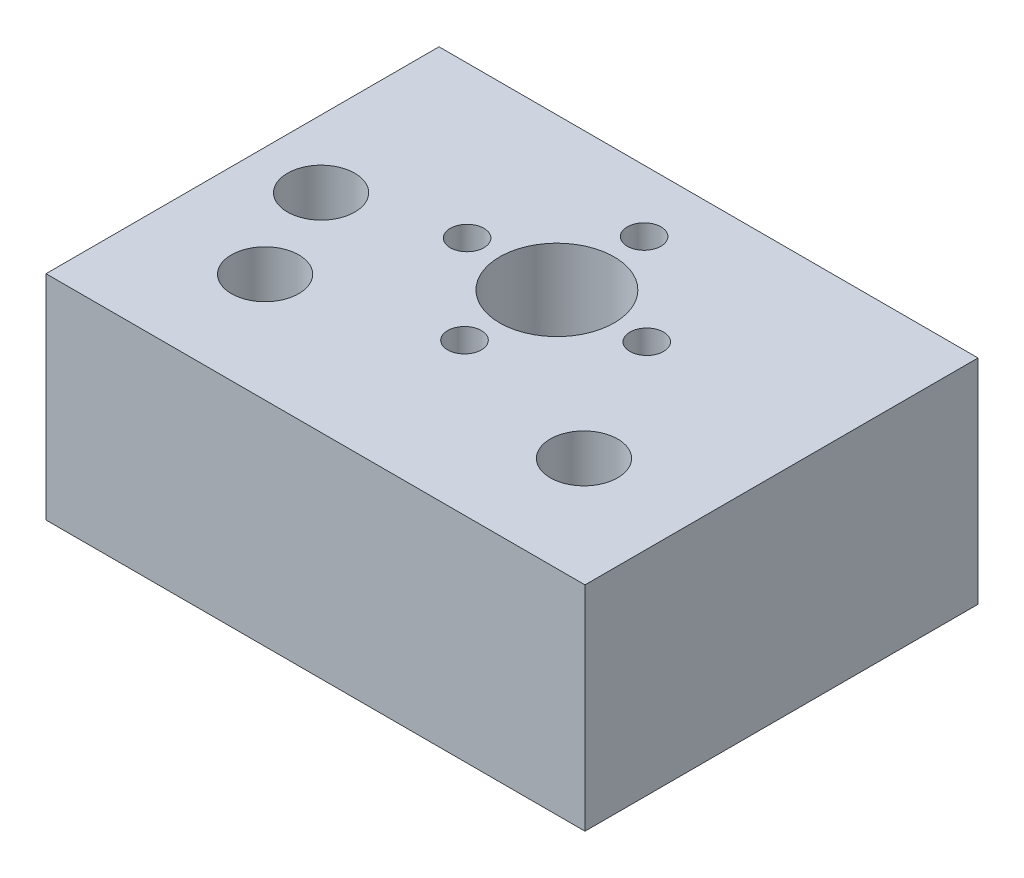
from build123d import *

# Parameters (mm, degrees)
ESBO_O1_W                = 48
ESBO_O1_H                = 35
RESSALTO_EXTRUS_O1_DEPTH = 19
ESBO_O4_R                = 5.1
CORTE_EXTRUS_O3_DEPTH    = 25
ESBO_O7_R                = 3
CORTE_EXTRUS_O7_DEPTH    = 63.369864518
ESBO_O8_R                = 3
CORTE_EXTRUS_O8_DEPTH    = 63.369864518
ESBO_O9_R                = 2
CORTE_EXTRUS_O9_DEPTH    = 17
ESBO_O6_R                = 1.5
CORTE_EXTRUS_O10_DEPTH   = 10


with BuildPart() as part:
    # Esboço1 → Ressalto-extrusão1 (new body)
    with BuildSketch(Plane(origin=(0, 0, 0), x_dir=(1, 0, 0), z_dir=(0, 1, 0))):
        with Locations((24, 17.5)):
            Rectangle(ESBO_O1_W, ESBO_O1_H)
    extrude(amount=RESSALTO_EXTRUS_O1_DEPTH)

    # Esboço4 → Corte-extrusão3 (cut)
    with BuildSketch(Plane(origin=(0, 19, 0), x_dir=(1, 0, 0), z_dir=(0, 1, 0))):
        with Locations(Location((24, 21.5, 0), (0, 0, 270))):
            Circle(ESBO_O4_R)
    extrude(amount=-CORTE_EXTRUS_O3_DEPTH, mode=Mode.SUBTRACT)

    # Esboço7 → Corte-extrusão7 (cut, through all)
    with BuildSketch(Plane(origin=(0, 19, 0), x_dir=(1, 0, 0), z_dir=(0, 1, 0))):
        with Locations(Location((9.8, 9.71, 0), (0, 0, 270))):
            Circle(ESBO_O7_R)
        with Locations(Location((38.2, 9.71, 0), (0, 0, 270))):
            Circle(ESBO_O7_R)
    extrude(amount=-CORTE_EXTRUS_O7_DEPTH, mode=Mode.SUBTRACT)

    # Esboço8 → Corte-extrusão8 (cut, through all)
    with BuildSketch(Plane.XZ):
        with Locations(Location((6, -18.5, 0), (0, 0, 270))):
            Circle(ESBO_O8_R)
    extrude(amount=-CORTE_EXTRUS_O8_DEPTH, mode=Mode.SUBTRACT)

    # Esboço9 → Corte-extrusão9 (cut)
    with BuildSketch(Plane(origin=(0, 0, -35), x_dir=(-1, 0, 0), z_dir=(0, 0, -1))):
        with Locations((-6, 9.5)):
            Circle(ESBO_O9_R)
    extrude(amount=-CORTE_EXTRUS_O9_DEPTH, mode=Mode.SUBTRACT)

    # Esboço6 → Corte-extrusão10 (cut)
    with BuildSketch(Plane(origin=(0, 19, 0), x_dir=(1, 0, 0), z_dir=(0, 1, 0))):
        with Locations(Location((23.767635295, 29.496624703, 0), (0, 0, 270))):
            Circle(ESBO_O6_R)
        with Locations(Location((16, 21.5, 0), (0, 0, 270))):
            Circle(ESBO_O6_R)
        with Locations(Location((32, 21.5, 0), (0, 0, 270))):
            Circle(ESBO_O6_R)
        with Locations(Location((23.767635295, 13.503375297, 0), (0, 0, 270))):
            Circle(ESBO_O6_R)
    extrude(amount=-CORTE_EXTRUS_O10_DEPTH, mode=Mode.SUBTRACT)


solid = part.part
